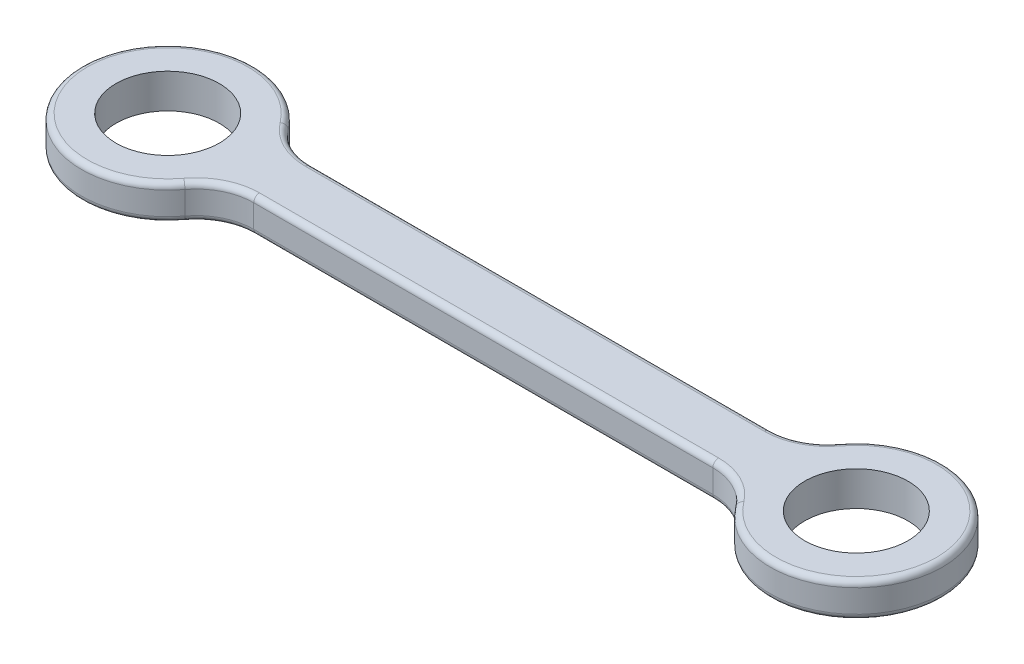
from build123d import *

# Parameters (mm, degrees)
SKETCH1_R           = 9
BOSS_EXTRUDE1_DEPTH = 6
FILLET1_R           = 1


with BuildPart() as part:
    # Sketch1 → Boss-Extrude1 (new body)
    with BuildSketch(Plane(origin=(0, 0, 0), x_dir=(1, 0, 0), z_dir=(0, 1, 0))):
        with BuildLine():
            Line((-28.045977011, 5), (51.954022989, 5))
            ThreePointArc((51.954022989, 5), (56.426158944, 6.05572809), (59.954022989, 9))
            ThreePointArc((59.954022989, 9), (86.954022989, 0), (59.954022989, -9))
            ThreePointArc((59.954022989, -9), (56.426158944, -6.05572809), (51.954022989, -5))
            Line((51.954022989, -5), (-28.045977011, -5))
            ThreePointArc((-28.045977011, -5), (-32.518112966, -6.05572809), (-36.045977011, -9))
            ThreePointArc((-36.045977011, -9), (-63.045977011, 0), (-36.045977011, 9))
            ThreePointArc((-36.045977011, 9), (-32.518112966, 6.05572809), (-28.045977011, 5))
        make_face()
        with Locations(Location((-48.045977011, 0, 0), (0, 0, 270))):
            Circle(SKETCH1_R, mode=Mode.SUBTRACT)
        with Locations(Location((71.954022989, 0, 0), (0, 0, 270))):
            Circle(SKETCH1_R, mode=Mode.SUBTRACT)
    extrude(amount=BOSS_EXTRUDE1_DEPTH)

    # Fillet1
    fillet1_edges = [part.edges().sort_by_distance(p)[0] for p in [
        (-63.045977011, 0, 0),
        (-32.518112966, 0, -6.05572809),
        (11.954022989, 0, -5),
        (56.426158944, 0, -6.05572809),
        (-32.518112966, 6, -6.05572809),
        (-63.045977011, 6, 0),
        (-32.518112966, 6, 6.05572809),
        (11.954022989, 6, 5),
        (56.426158944, 6, 6.05572809),
        (86.954022989, 6, 0),
        (56.426158944, 6, -6.05572809),
        (86.954022989, 0, 0),
        (11.954022989, 6, -5),
        (56.426158944, 0, 6.05572809),
        (11.954022989, 0, 5),
        (-32.518112966, 0, 6.05572809),
    ]]
    fillet(fillet1_edges, radius=FILLET1_R)


solid = part.part
